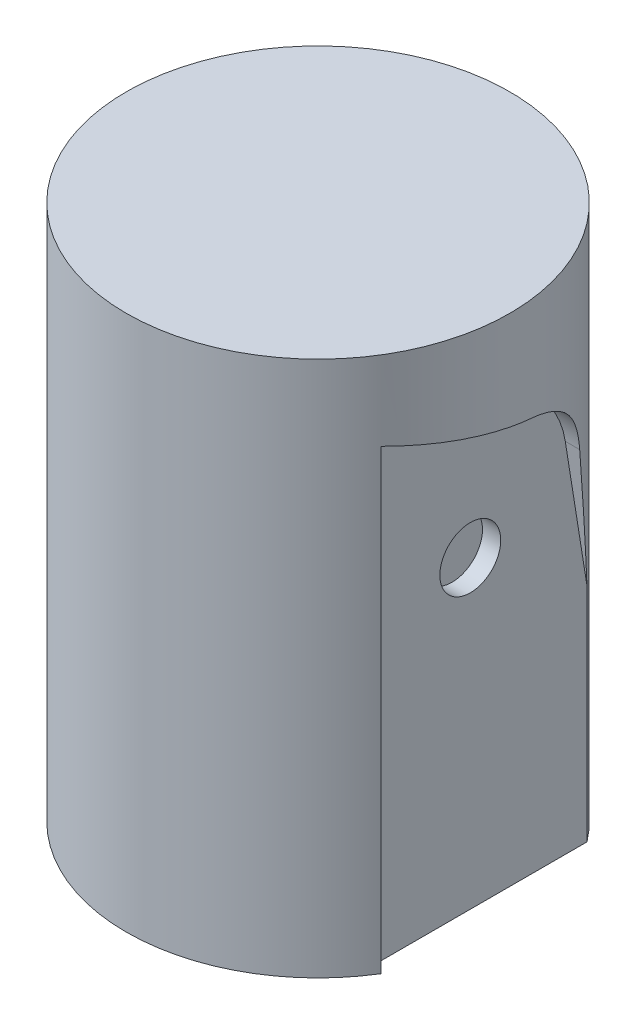
from build123d import *

# Parameters (mm, degrees)
SKETCH_1_R          = 31.5
EXTRUDE_1_DEPTH     = 88
CUT_EXTRUDE_1_DEPTH = 6.5
SKETCH_3_R          = 5
CUT_EXTRUDE_2_DEPTH = 3


with BuildPart() as part:
    # 草图1 → 凸台-拉伸1 (new body)
    with BuildSketch(Plane(origin=(0, 0, 0), x_dir=(1, 0, 0), z_dir=(0, 1, 0))):
        with Locations(Location((0, 0, 0), (0, 0, 270))):
            Circle(SKETCH_1_R)
    extrude(amount=EXTRUDE_1_DEPTH)

    # 草图2 → 切除-拉伸1 (cut)
    with BuildSketch(Plane(origin=(31.5, 0, 0), x_dir=(0, 0, -1), z_dir=(1, 0, 0))):
        with BuildLine():
            Line((-16.5, 75), (3.625312861, 71.114880191))
            ThreePointArc((3.625312861, 71.114880191), (11.558802441, 66.820544019), (15.59440661, 58.752367083))
            Line((15.59440661, 58.752367083), (24.977312136, 0))
            Line((24.977312136, 0), (-16.5, 0))
            Line((-16.5, 0), (-16.5, 75))
        make_face()
    cut_extrude_1 = extrude(amount=-CUT_EXTRUDE_1_DEPTH, mode=Mode.SUBTRACT)

    # 镜向1: 切除-拉伸1 across plane
    add(cut_extrude_1.mirror(Plane(origin=(0, 0, 0), x_dir=(0, 0, 1), z_dir=(1, 0, 0))), mode=Mode.SUBTRACT)

    # 草图3 → 切除-拉伸2 (cut)
    with BuildSketch(Plane(origin=(25, 0, 0), x_dir=(0, 0, -1), z_dir=(1, 0, 0))):
        with Locations((0, 50)):
            Circle(SKETCH_3_R)
    cut_extrude_2 = extrude(amount=-CUT_EXTRUDE_2_DEPTH, mode=Mode.SUBTRACT)

    # 镜向2: 切除-拉伸2 across plane
    add(cut_extrude_2.mirror(Plane(origin=(0, 0, 0), x_dir=(0, 0, 1), z_dir=(1, 0, 0))), mode=Mode.SUBTRACT)


solid = part.part
